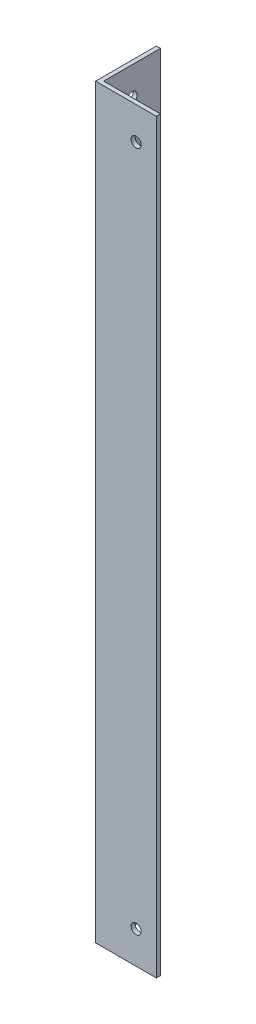
from build123d import *

# Parameters (mm, degrees)
SKETCH_1_W      = 15
SKETCH_1_H      = 1
EXTRUDE_1_DEPTH = 184
SKETCH_3_W      = 1
SKETCH_3_H      = 184
EXTRUDE_2_DEPTH = 14
M3X0_5_1_D      = 2.5
M3X0_5_2_D      = 2.5


with BuildPart() as part:
    # ｽｹｯﾁ1 → ﾎﾞｽ - 押し出し1 (new body)
    with BuildSketch(Plane(origin=(0, 0, 0), x_dir=(1, 0, 0), z_dir=(0, 1, 0))):
        with Locations((7.5, -0.5)):
            Rectangle(SKETCH_1_W, SKETCH_1_H)
    extrude(amount=EXTRUDE_1_DEPTH)

    # ｽｹｯﾁ3 → ﾎﾞｽ - 押し出し2 (add)
    with BuildSketch(Plane(origin=(0, 0, 0), x_dir=(-1, 0, 0), z_dir=(0, 0, -1))):
        with Locations((-0.5, 92)):
            Rectangle(SKETCH_3_W, SKETCH_3_H)
    extrude(amount=EXTRUDE_2_DEPTH)

    # M3x0.5 ねじ穴1 (through all)
    with Locations(Plane.ZY):
        with Locations((-7, 7), (-7, 177)):
            Hole(M3X0_5_1_D / 2)

    # M3x0.5 ねじ穴2 (through all)
    with Locations(Plane.XY.offset(1)):
        with Locations((10, 8), (10, 176)):
            Hole(M3X0_5_2_D / 2)


solid = part.part
